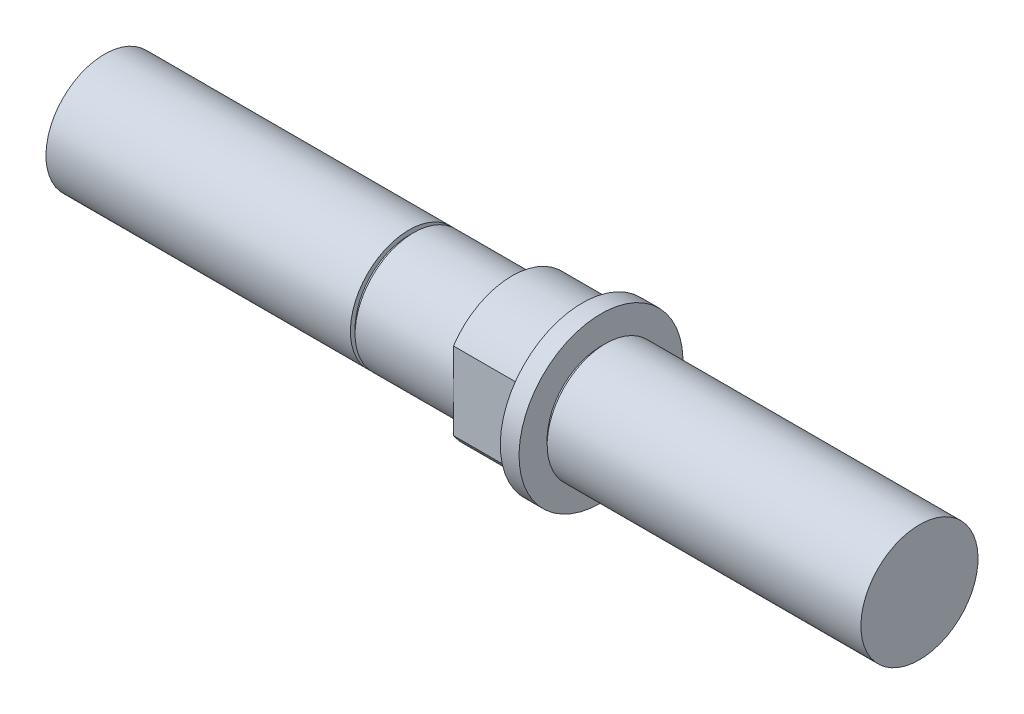
from build123d import *

# Parameters (mm, degrees)
SKETCH3_W          = 1
SKETCH3_H          = 1
SKETCH5_OUTSIDE_W  = 73.18
SKETCH5_OUTSIDE_H  = 73.18
CUT_EXTRUDE1_DEPTH = 15


with BuildPart() as part:
    # Sketch2 → Revolve1 (revolve)
    with BuildSketch(Plane.XY, mode=Mode.PRIVATE) as revolve1_sk:
        Polygon((0, 0), (0, 12.5), (-68, 12.5), (-68, 17.5), (-72, 17.5), (-72, 15), (-87, 15), (-87, 12.5), (-174, 12.5), (-174, 0), align=None)
    revolve(revolve1_sk.sketch.rotate(Axis((-174, 0, 0), (1, 0, 0)), 180), axis=Axis((-174, 0, 0), (1, 0, 0)))

    # Sketch3 → Cut-Revolve1 (revolve, cut)
    with BuildSketch(Plane.XY, mode=Mode.PRIVATE) as cut_revolve1_sk:
        with Locations((-67.5, 12)):
            Rectangle(SKETCH3_W, SKETCH3_H)
        with Locations((-108.5, 12)):
            Rectangle(SKETCH3_W, SKETCH3_H)
    revolve(cut_revolve1_sk.sketch.rotate(Axis((0, 0, 0), (-1, 0, 0)), 180), axis=Axis((0, 0, 0), (-1, 0, 0)), mode=Mode.SUBTRACT)

    # Sketch5 outside → Cut-Extrude1 (cut)
    with BuildSketch(Plane.ZY.offset(87)):
        Rectangle(SKETCH5_OUTSIDE_W, SKETCH5_OUTSIDE_H)
        with BuildLine():
            Line((-12.5, 8.291561976), (-12.5, -8.291561976))
            ThreePointArc((-12.5, -8.291561976), (0, -15), (12.5, -8.291561976))
            Line((12.5, -8.291561976), (12.5, 8.291561976))
            ThreePointArc((12.5, 8.291561976), (0, 15), (-12.5, 8.291561976))
        make_face(mode=Mode.SUBTRACT)
    extrude(amount=-CUT_EXTRUDE1_DEPTH, mode=Mode.SUBTRACT)


solid = part.part
